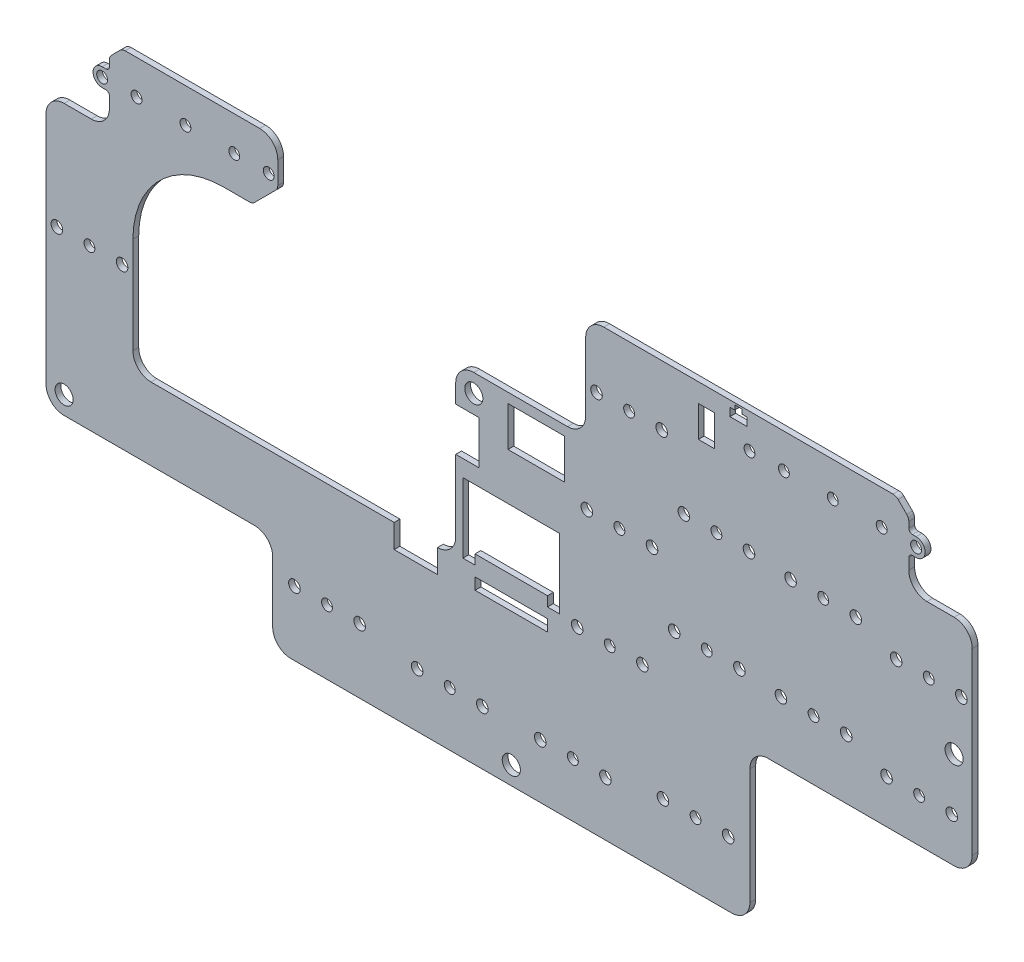
from build123d import *

# Parameters (mm, degrees)
SKETCH18_R          = 2.5
BOSS_EXTRUDE1_DEPTH = 1.6
SKETCH25_R          = 1.5
CUT_EXTRUDE2_DEPTH  = 300.671737188
SKETCH20_W          = 4.5
SKETCH20_H          = 8.6
SKETCH20_W_2        = 4.7
SKETCH20_H_2        = 2.25
SKETCH20_W_3        = 2
SKETCH20_H_3        = 1.25
CUT_EXTRUDE3_DEPTH  = 300.671737188
SKETCH22_W          = 6.5
SKETCH22_H          = 12
SKETCH22_W_2        = 12
SKETCH22_H_2        = 6.5
CUT_EXTRUDE4_DEPTH  = 300.671737188
SKETCH3_W           = 19.993534169
SKETCH3_H           = 3.2
CUT_EXTRUDE5_DEPTH  = 300.671737188
SKETCH5_W           = 15.55
SKETCH5_H           = 11
CUT_EXTRUDE7_DEPTH  = 300.671737188
SKETCH16_R          = 1.6
CUT_EXTRUDE8_DEPTH  = 300.671737188


with BuildPart() as part:
    # Sketch18 → Boss-Extrude1 (new body)
    with BuildSketch(Plane.XY):
        with BuildLine():
            Line((125.541946024, 99.938694526), (125.541946024, 63.085390407))
            ThreePointArc((125.541946024, 63.085390407), (124.07747993, 59.549856501), (120.541946024, 58.085390407))
            Line((120.541946024, 58.085390407), (41.41186441, 58.085390407))
            ThreePointArc((41.41186441, 58.085390407), (37.876330504, 59.549856501), (36.41186441, 63.085390407))
            Line((36.41186441, 63.085390407), (36.41186441, 89.738694526))
            ThreePointArc((36.41186441, 89.738694526), (43.73419488, 107.416364055), (61.41186441, 114.738694526))
            Line((61.41186441, 114.738694526), (68.583437285, 114.738694526))
            ThreePointArc((68.583437285, 114.738694526), (69.34880415, 114.890935461), (69.997650848, 115.324480963))
            Line((69.997650848, 115.324480963), (75.826077972, 121.152908088))
            ThreePointArc((75.826077972, 121.152908088), (76.259623475, 121.801754786), (76.41186441, 122.56712165))
            Line((76.41186441, 122.56712165), (76.41186441, 128.738694526))
            ThreePointArc((76.41186441, 128.738694526), (74.947398316, 132.274228432), (71.41186441, 133.738694526))
            Line((71.41186441, 133.738694526), (34.275825441, 133.738694526))
            ThreePointArc((34.275825441, 133.738694526), (33.510458576, 133.586453591), (32.861611878, 133.152908088))
            Line((32.861611878, 133.152908088), (30.508058488, 130.799354697))
            ThreePointArc((30.508058488, 130.799354697), (30.074512985, 130.150508), (29.92227205, 129.385141135))
            Line((29.92227205, 129.385141135), (29.92227205, 127.738694526))
            ThreePointArc((29.92227205, 127.738694526), (29.629378831, 127.031587745), (28.92227205, 126.738694526))
            Line((28.92227205, 126.738694526), (27.91186441, 126.738694526))
            ThreePointArc((27.91186441, 126.738694526), (25.41186441, 124.238694526), (27.91186441, 121.738694526))
            Line((27.91186441, 121.738694526), (28.92227205, 121.738694526))
            ThreePointArc((28.92227205, 121.738694526), (29.629378831, 121.445801307), (29.92227205, 120.738694526))
            Line((29.92227205, 120.738694526), (29.92227205, 117.728286886))
            ThreePointArc((29.92227205, 117.728286886), (28.457805956, 114.19275298), (24.92227205, 112.728286886))
            Line((24.92227205, 112.728286886), (17.41186441, 112.728286886))
            ThreePointArc((17.41186441, 112.728286886), (13.876330504, 111.263820792), (12.41186441, 107.728286886))
            Line((12.41186441, 107.728286886), (12.41186441, 43.085390407))
            ThreePointArc((12.41186441, 43.085390407), (13.876330504, 39.549856501), (17.41186441, 38.085390407))
            Line((17.41186441, 38.085390407), (70.009210849, 38.085390407))
            ThreePointArc((70.009210849, 38.085390407), (73.544744755, 36.620924313), (75.009210849, 33.085390407))
            Line((75.009210849, 33.085390407), (75.009210849, 16.270067852))
            ThreePointArc((75.009210849, 16.270067852), (76.473676943, 12.734533946), (80.009210849, 11.270067852))
            Line((80.009210849, 11.270067852), (201.774681199, 11.270067852))
            ThreePointArc((201.774681199, 11.270067852), (205.310215105, 12.734533946), (206.774681199, 16.270067852))
            Line((206.774681199, 16.270067852), (206.774681199, 48.274150291))
            ThreePointArc((206.774681199, 48.274150291), (208.239147293, 51.809684196), (211.774681199, 53.274150291))
            Line((211.774681199, 53.274150291), (263.168886442, 53.274150291))
            ThreePointArc((263.168886442, 53.274150291), (266.704420348, 54.738616385), (268.168886442, 58.274150291))
            Line((268.168886442, 58.274150291), (268.168886442, 107.728286886))
            ThreePointArc((268.168886442, 107.728286886), (266.704420348, 111.263820792), (263.168886442, 112.728286886))
            Line((263.168886442, 112.728286886), (255.658478802, 112.728286886))
            ThreePointArc((255.658478802, 112.728286886), (252.122944896, 114.19275298), (250.658478802, 117.728286886))
            Line((250.658478802, 117.728286886), (250.658478802, 120.738694526))
            ThreePointArc((250.658478802, 120.738694526), (250.951372021, 121.445801307), (251.658478802, 121.738694526))
            Line((251.658478802, 121.738694526), (252.668886442, 121.738694526))
            ThreePointArc((252.668886442, 121.738694526), (255.168886442, 124.238694526), (252.668886442, 126.738694526))
            Line((252.668886442, 126.738694526), (251.658478802, 126.738694526))
            ThreePointArc((251.658478802, 126.738694526), (250.951372021, 127.031587745), (250.658478802, 127.738694526))
            Line((250.658478802, 127.738694526), (250.658478802, 129.385141135))
            ThreePointArc((250.658478802, 129.385141135), (250.506237867, 130.150508), (250.072692364, 130.799354697))
            Line((250.072692364, 130.799354697), (247.719138974, 133.152908088))
            ThreePointArc((247.719138974, 133.152908088), (247.070292276, 133.586453591), (246.304925411, 133.738694526))
            Line((246.304925411, 133.738694526), (166.429012786, 133.738694526))
            ThreePointArc((166.429012786, 133.738694526), (162.893478881, 132.274228432), (161.429012786, 128.738694526))
            Line((161.429012786, 128.738694526), (161.429012786, 109.938694526))
            ThreePointArc((161.429012786, 109.938694526), (159.964546692, 106.40316062), (156.429012786, 104.938694526))
            Line((156.429012786, 104.938694526), (130.541946024, 104.938694526))
            ThreePointArc((130.541946024, 104.938694526), (127.006412118, 103.474228432), (125.541946024, 99.938694526))
        make_face()
        with Locations((17.41186441, 43.085390407)):
            Circle(SKETCH18_R, mode=Mode.SUBTRACT)
        with Locations((140.891946024, 16.270067852)):
            Circle(SKETCH18_R, mode=Mode.SUBTRACT)
        with Locations((130.541946024, 99.938694526)):
            Circle(SKETCH18_R, mode=Mode.SUBTRACT)
        with Locations((263.168886442, 79.964143119)):
            Circle(SKETCH18_R, mode=Mode.SUBTRACT)
    extrude(amount=BOSS_EXTRUDE1_DEPTH)

    # Sketch25 → Cut-Extrude2 (cut, through all)
    with BuildSketch(Plane.XY):
        with Locations((27.91186441, 124.238694526)):
            Circle(SKETCH25_R)
        with Locations((37.41186441, 124.238694526)):
            Circle(SKETCH25_R)
        with Locations((50.91186441, 124.238694526)):
            Circle(SKETCH25_R)
        with Locations((64.41186441, 124.238694526)):
            Circle(SKETCH25_R)
        with Locations((73.91186441, 124.238694526)):
            Circle(SKETCH25_R)
        with Locations((24.41186441, 82.179064133)):
            Circle(SKETCH25_R)
        with Locations((90.009210849, 29.091460603)):
            Circle(SKETCH25_R)
        with Locations((123.891946024, 26.270067852)):
            Circle(SKETCH25_R)
        with Locations((157.891946024, 26.270067852)):
            Circle(SKETCH25_R)
        with Locations((191.774681199, 29.091460603)):
            Circle(SKETCH25_R)
        with Locations((168.091946024, 58.360067852)):
            Circle(SKETCH25_R)
        with Locations((194.873540874, 70.729230202)):
            Circle(SKETCH25_R)
        with Locations((224.358659158, 69.792320505)):
            Circle(SKETCH25_R)
        with Locations((253.510608286, 65.274150291)):
            Circle(SKETCH25_R)
        with Locations((256.168886442, 94.654135948)):
            Circle(SKETCH25_R)
        with Locations((227.016937315, 99.172306162)):
            Circle(SKETCH25_R)
        with Locations((197.531819031, 100.10921586)):
            Circle(SKETCH25_R)
        with Locations((170.75022418, 87.740053509)):
            Circle(SKETCH25_R)
        with Locations((252.668886442, 124.238694526)):
            Circle(SKETCH25_R)
        with Locations((243.168886442, 124.238694526)):
            Circle(SKETCH25_R)
        with Locations((229.668886442, 124.238694526)):
            Circle(SKETCH25_R)
        with Locations((216.168886442, 124.238694526)):
            Circle(SKETCH25_R)
        with Locations((206.668886442, 124.238694526)):
            Circle(SKETCH25_R)
        with Locations((173.429012786, 117.118176179)):
            Circle(SKETCH25_R)
    extrude(amount=CUT_EXTRUDE2_DEPTH, mode=Mode.SUBTRACT)

    # Sketch20 → Cut-Extrude3 (cut, through all)
    with BuildSketch(Plane.XY):
        with Locations((194.798949614, 124.238694526)):
            Rectangle(SKETCH20_W, SKETCH20_H)
        with Locations((203.608918028, 130.863694526)):
            Rectangle(SKETCH20_W_2, SKETCH20_H_2)
        with Locations((203.608918028, 132.613694526)):
            Rectangle(SKETCH20_W_3, SKETCH20_H_3)
    extrude(amount=CUT_EXTRUDE3_DEPTH, mode=Mode.SUBTRACT)

    # Sketch22 → Cut-Extrude4 (cut, through all)
    with BuildSketch(Plane.XY):
        with Locations((128.791946024, 88.866614533)):
            Rectangle(SKETCH22_W, SKETCH22_H)
        with Locations((114.541946024, 54.835390407)):
            Rectangle(SKETCH22_W_2, SKETCH22_H_2)
    extrude(amount=CUT_EXTRUDE4_DEPTH, mode=Mode.SUBTRACT)

    # Sketch3 → Cut-Extrude5 (cut, through all)
    with BuildSketch(Plane.XY):
        Polygon((127.541946024, 59.034534541), (130.891946024, 59.034534541), (130.891946024, 61.734534541), (150.891946024, 61.734534541), (150.891946024, 59.034534541), (154.241946024, 59.034534541), (154.241946024, 78.294534541), (127.541946024, 78.294534541), align=None)
        with Locations((140.891946023, 54.634534541)):
            Rectangle(SKETCH3_W, SKETCH3_H)
    extrude(amount=CUT_EXTRUDE5_DEPTH, mode=Mode.SUBTRACT)

    # Sketch5 → Cut-Extrude7 (cut, through all)
    with BuildSketch(Plane.XY):
        with Locations((147.75540719, 96.738694526)):
            Rectangle(SKETCH5_W, SKETCH5_H)
    extrude(amount=CUT_EXTRUDE7_DEPTH, mode=Mode.SUBTRACT)

    # Sketch16 → Cut-Extrude8 (cut, through all)
    with BuildSketch(Plane.XY):
        with Locations((15.41186441, 82.179064133)):
            Circle(SKETCH16_R)
        with Locations((33.41186441, 82.179064133)):
            Circle(SKETCH16_R)
        with Locations((81.009210849, 29.091460603)):
            Circle(SKETCH16_R)
        with Locations((99.009210849, 29.091460603)):
            Circle(SKETCH16_R)
        with Locations((114.891946024, 26.270067852)):
            Circle(SKETCH16_R)
        with Locations((132.891946024, 26.270067852)):
            Circle(SKETCH16_R)
        with Locations((148.891946024, 26.270067852)):
            Circle(SKETCH16_R)
        with Locations((166.891946024, 26.270067852)):
            Circle(SKETCH16_R)
        with Locations((182.774681199, 29.091460603)):
            Circle(SKETCH16_R)
        with Locations((200.774681199, 29.091460603)):
            Circle(SKETCH16_R)
        with Locations((164.429012786, 117.118176179)):
            Circle(SKETCH16_R)
        with Locations((182.429012786, 117.118176179)):
            Circle(SKETCH16_R)
        with Locations((161.75022418, 87.740053509)):
            Circle(SKETCH16_R)
        with Locations((179.75022418, 87.740053509)):
            Circle(SKETCH16_R)
        with Locations((188.531819031, 100.10921586)):
            Circle(SKETCH16_R)
        with Locations((206.531819031, 100.10921586)):
            Circle(SKETCH16_R)
        with Locations((159.091946024, 58.360067852)):
            Circle(SKETCH16_R)
        with Locations((177.091946024, 58.360067852)):
            Circle(SKETCH16_R)
        with Locations((185.873540874, 70.729230202)):
            Circle(SKETCH16_R)
        with Locations((203.873540874, 70.729230202)):
            Circle(SKETCH16_R)
        with Locations((218.016937315, 99.172306162)):
            Circle(SKETCH16_R)
        with Locations((236.016937315, 99.172306162)):
            Circle(SKETCH16_R)
        with Locations((215.358659158, 69.792320505)):
            Circle(SKETCH16_R)
        with Locations((233.358659158, 69.792320505)):
            Circle(SKETCH16_R)
        with Locations((247.168886442, 94.654135948)):
            Circle(SKETCH16_R)
        with Locations((265.168886442, 94.654135948)):
            Circle(SKETCH16_R)
        with Locations((244.510608286, 65.274150291)):
            Circle(SKETCH16_R)
        with Locations((262.510608286, 65.274150291)):
            Circle(SKETCH16_R)
    extrude(amount=CUT_EXTRUDE8_DEPTH, mode=Mode.SUBTRACT)


solid = part.part
